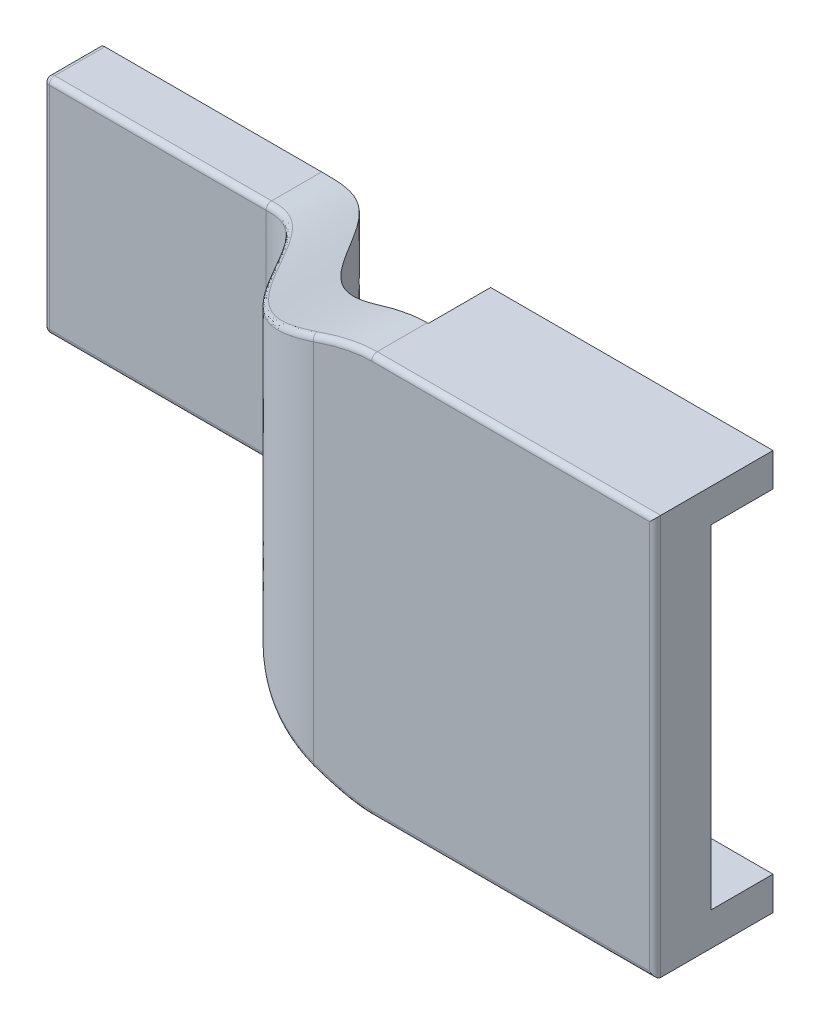
from build123d import *

# Parameters (mm, degrees)
ESQUISSE1_W             = 44.6
ESQUISSE1_H             = 36
ESQUISSE1_W_2           = 25.4
BOSS_EXTRU_1_DEPTH      = 5
ESQUISSE2_W             = 25.4
ESQUISSE2_H             = 3
BOSS_EXTRU_2_DEPTH      = 5.6
ESQUISSE3_W             = 40
ESQUISSE3_H             = 36
BOSS_EXTRU_4_DEPTH      = 15
ENL_V_MAT_EXTRU_3_DEPTH = 60.246603278
ESQUISSE7_W             = 20
ESQUISSE7_H             = 8
ENL_V_MAT_EXTRU_4_DEPTH = 61.70551886
CONG_4_R                = 0.5


with BuildPart() as part:
    # Esquisse1 → Boss.-Extru.1 (new body)
    with BuildSketch(Plane.XY):
        with Locations((-22.3, 18)):
            Rectangle(ESQUISSE1_W, ESQUISSE1_H)
        with Locations((12.7, 18)):
            Rectangle(ESQUISSE1_W_2, ESQUISSE1_H)
    extrude(amount=BOSS_EXTRU_1_DEPTH)

    # Esquisse2 → Boss.-Extru.2 (add)
    with BuildSketch(Plane(origin=(0, 0, 0), x_dir=(-1, 0, 0), z_dir=(0, 0, -1))):
        with Locations((-12.7, 1.5)):
            Rectangle(ESQUISSE2_W, ESQUISSE2_H)
        with Locations((-12.7, 34.5)):
            Rectangle(ESQUISSE2_W, ESQUISSE2_H)
    extrude(amount=BOSS_EXTRU_2_DEPTH)

    # Esquisse3 → Boss.-Extru.4 (add)
    with BuildSketch(Plane(origin=(0, 0, 0), x_dir=(-1, 0, 0), z_dir=(0, 0, -1))):
        with Locations((24.6, 18)):
            Rectangle(ESQUISSE3_W, ESQUISSE3_H)
    extrude(amount=BOSS_EXTRU_4_DEPTH)

    # Esquisse4 → Enlèv. mat.-Extru.3 (cut, through all)
    with BuildSketch(Plane(origin=(0, 36, 0), x_dir=(1, 0, 0), z_dir=(0, 1, 0))):
        with BuildLine():
            Line((-24.6, 10), (-44.6, 10))
            Line((-44.6, 10), (-44.6, -5))
            Line((-44.6, -5), (-9.6, -5))
            Line((-9.6, -5), (-5.318745152, -5))
            add(Edge.make_bspline(
                [(-24.6, 10), (-18.581113582, 10.250438225), (-16.538607269, -4.688596284), (-5.318745152, -5)],
                knots=[0, 0, 0, 0, 0.979442109, 0.979442109, 0.979442109, 0.979442109], degree=3))
        make_face()
        with BuildLine():
            Line((-4.6, 15), (-24.6, 15))
            add(Edge.make_bspline(
                [(-4.6, 0), (-13.772339743, 0.318713019), (-15.546263661, 14.974819889), (-24.6, 15)],
                knots=[0, 0, 0, 0, 1, 1, 1, 1], degree=3))
            Line((-4.6, 0), (-4.6, 15))
        make_face()
    extrude(amount=-ENL_V_MAT_EXTRU_3_DEPTH, mode=Mode.SUBTRACT)

    # Esquisse7 → Enlèv. mat.-Extru.4 (cut, through all)
    with BuildSketch(Plane(origin=(0, 0, -15), x_dir=(-1, 0, 0), z_dir=(0, 0, -1))):
        with Locations((34.6, 4)):
            Rectangle(ESQUISSE7_W, ESQUISSE7_H)
        with BuildLine():
            Line((24.6, 0), (24.6, 8))
            add(Edge.make_bspline(
                [(0.1, 0), (6.766666667, 0), (17.933333333, 8), (24.6, 8)],
                knots=[0, 0, 0, 0, 1, 1, 1, 1], degree=3))
            Line((0.1, 0), (24.6, 0))
        make_face()
        with BuildLine():
            add(Edge.make_bspline(
                [(24.6, 28), (17.933333333, 28), (6.766666667, 36), (0.1, 36)],
                knots=[0, 0, 0, 0, 1, 1, 1, 1], degree=3))
            Line((24.6, 28), (24.6, 36))
            Line((24.6, 36), (0.1, 36))
        make_face()
        with Locations((34.6, 32)):
            Rectangle(ESQUISSE7_W, ESQUISSE7_H)
    extrude(amount=-ENL_V_MAT_EXTRU_4_DEPTH, mode=Mode.SUBTRACT)

    # Congé4
    cong_4_edges = [part.edges().sort_by_distance(p)[0] for p in [
        (-15.717570787, 30.513571579, -1.106703523),
        (-44.6, 28, -12.5),
        (-2.74987965, 35.666138518, 5),
        (12.65, 0, 5),
        (25.4, 18, 5),
        (12.65, 36, 5),
        (-44.6, 18, -10),
        (-34.6, 28, -10),
        (-34.6, 8, -10),
        (-15.717570798, 5.486428428, -1.10670351),
        (-44.6, 8, -12.5),
        (-2.749879652, 0.333861473, 5),
    ]]
    fillet(cong_4_edges, radius=CONG_4_R)


solid = part.part
